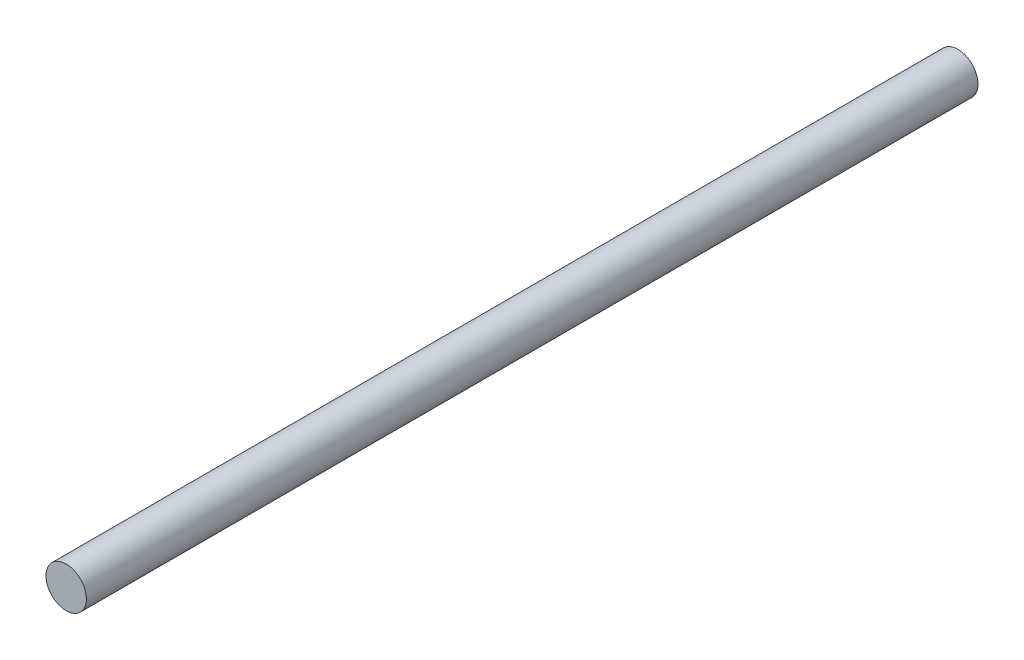
from build123d import *

# Parameters (mm, degrees)
SKETCH1_R           = 2.159
BOSS_EXTRUDE1_DEPTH = 95.25


with BuildPart() as part:
    # Sketch1 → Boss-Extrude1 (new body)
    with BuildSketch(Plane.XY):
        Circle(SKETCH1_R)
    extrude(amount=BOSS_EXTRUDE1_DEPTH)


solid = part.part
